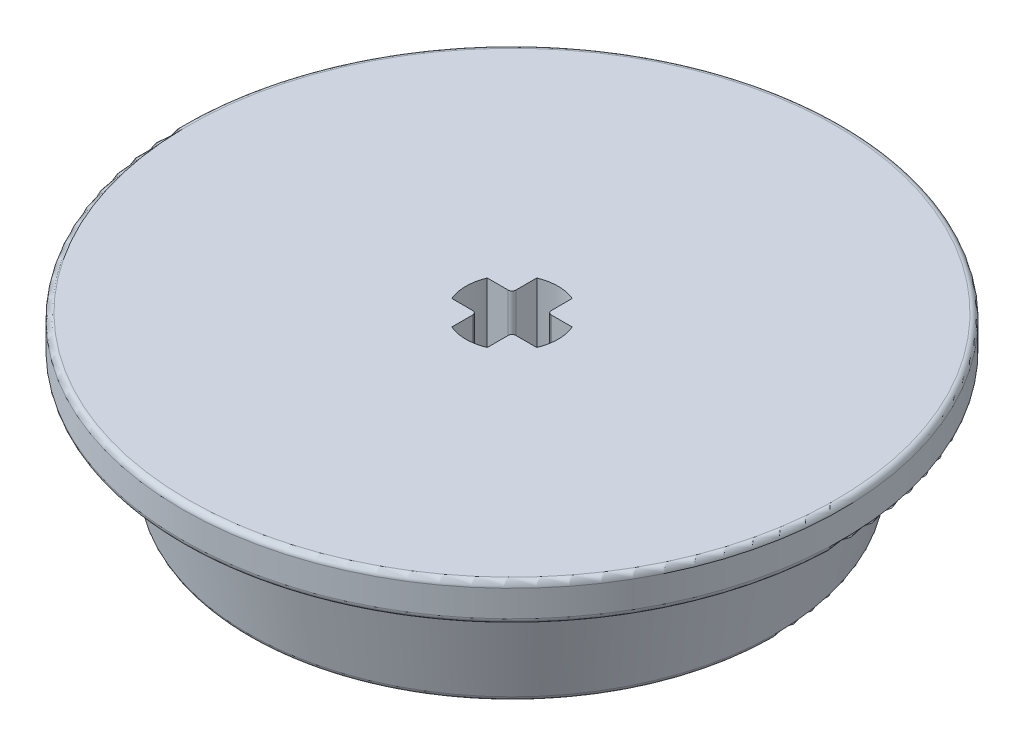
from build123d import *

# Parameters (mm, degrees)
CUT_EXTRUDE1_DEPTH = 26.956426849
FILLET1_R          = 0.2
FILLET2_R          = 0.3


with BuildPart() as part:
    # Sketch2 → Revolve1 (revolve)
    with BuildSketch(Plane.XY, mode=Mode.PRIVATE) as revolve1_sk:
        Polygon((0, 0), (17.460470996, 0), (17.460470996, -2), (15, -2), (13.9155, -8), (0, -8), align=None)
    revolve(revolve1_sk.sketch.rotate(Axis((0, 0, 0), (0, 1, 0)), 90), axis=Axis((0, 0, 0), (0, 1, 0)))

    # Sketch1 → Cut-Extrude1 (cut, through all)
    with BuildSketch(Plane(origin=(0, 0, 0), x_dir=(1, 0, 0), z_dir=(0, 1, 0))):
        with BuildLine():
            Line((-0.94, 0.94), (-2.25166605, 0.94))
            ThreePointArc((-2.25166605, 0.94), (-2.44, 0), (-2.25166605, -0.94))
            Line((-2.25166605, -0.94), (-0.94, -0.94))
            Line((-0.94, -0.94), (-0.94, -2.25166605))
            ThreePointArc((-0.94, -2.25166605), (0, -2.44), (0.94, -2.25166605))
            Line((0.94, -2.25166605), (0.94, -0.94))
            Line((0.94, -0.94), (2.25166605, -0.94))
            ThreePointArc((2.25166605, -0.94), (2.44, 0), (2.25166605, 0.94))
            Line((2.25166605, 0.94), (0.94, 0.94))
            Line((0.94, 0.94), (0.94, 2.25166605))
            ThreePointArc((0.94, 2.25166605), (0, 2.44), (-0.94, 2.25166605))
            Line((-0.94, 2.25166605), (-0.94, 0.94))
        make_face()
    extrude(amount=-CUT_EXTRUDE1_DEPTH, mode=Mode.SUBTRACT)

    # Fillet1
    fillet1_edges = [part.edges().sort_by_distance(p)[0] for p in [
        (-0.94, -4, -0.94),
        (0.94, -4, -0.94),
        (0.94, -4, 0.94),
        (-0.94, -4, 0.94),
    ]]
    fillet(fillet1_edges, radius=FILLET1_R)

    # Fillet2
    fillet2_edges = [part.edges().sort_by_distance(p)[0] for p in [
        (0, -8, 13.9155),
        (0, -2, 15),
        (0, -2, 17.460470996),
        (0, 0, 17.460470996),
    ]]
    fillet(fillet2_edges, radius=FILLET2_R)


solid = part.part
